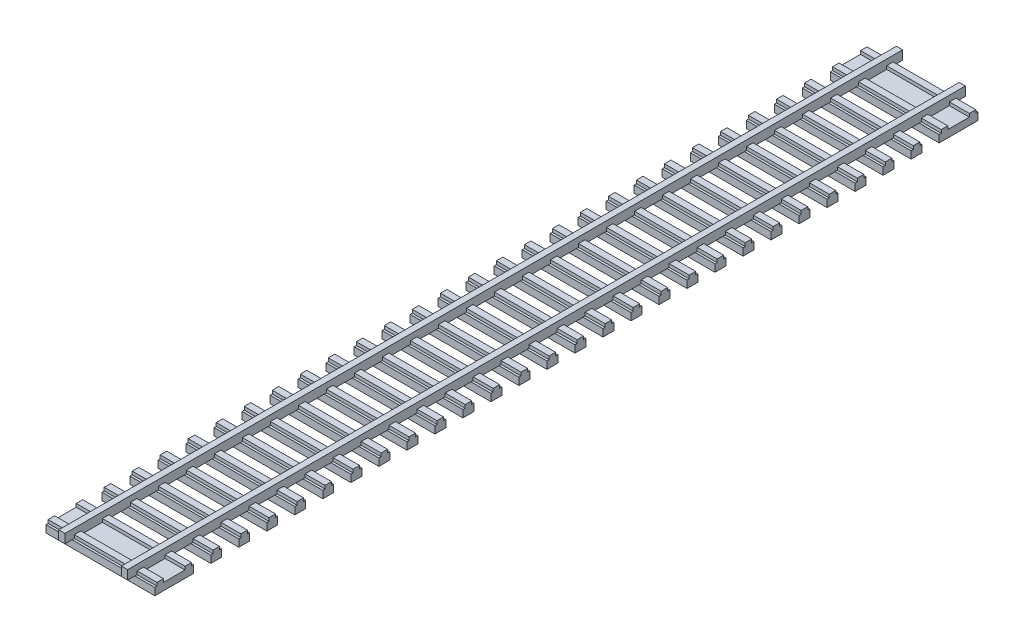
from build123d import *

# Parameters (mm, degrees)
SKETCH_1_W             = 1.71
SKETCH_1_H             = 2.5
EXTRUDE_1_DEPTH        = 115.5
EXTRUDE_1_2_DEPTH      = 115.5
SKETCH_2_W             = 3
SKETCH_2_H             = 2
SKETCH_2_W_2           = 1.8
SKETCH_2_H_2           = 0.9
EXTRUDE_2_DEPTH        = 15
PATTERN_LINEAR_1_COUNT = 30
PATTERN_LINEAR_1_PITCH = 7.724137931
SKETCH_3_W             = 4.724137931
SKETCH_3_H             = 2
EXTRUDE_3_DEPTH        = 30


with BuildPart() as part:
    # Эскиз1 → Бобышка-Вытянуть1 (new, symmetric)
    with BuildSketch(Plane.XY):
        with Locations((8.645, 1.25)):
            Rectangle(SKETCH_1_W, SKETCH_1_H)
    extrude(amount=EXTRUDE_1_DEPTH, both=True)



with BuildPart() as body_2:
    # Эскиз1 → Extrude 1 2 (new, symmetric)
    with BuildSketch(Plane.XY):
        with Locations((-8.645, 1.25)):
            Rectangle(SKETCH_1_W, SKETCH_1_H)
    extrude(amount=EXTRUDE_1_2_DEPTH, both=True)


with BuildPart() as part_1:
    add(part.part)

    add(body_2.part)  # Бобышка-Вытянуть2 merges body 2
    # Эскиз2 → Бобышка-Вытянуть2 (add, symmetric)
    with BuildSketch(Plane(origin=(0, 0, 0), x_dir=(0, 0, -1), z_dir=(1, 0, 0))):
        with Locations((-112, -1)):
            Rectangle(SKETCH_2_W, SKETCH_2_H)
        with Locations((-112, 0.45)):
            Rectangle(SKETCH_2_W_2, SKETCH_2_H_2)
    extrude_2 = extrude(amount=EXTRUDE_2_DEPTH, both=True)

    # Линейный массив1: Бобышка-Вытянуть2 ×30
    with Locations(*[(0, 0, -i * PATTERN_LINEAR_1_PITCH) for i in range(1, PATTERN_LINEAR_1_COUNT)]):
        add(extrude_2)

    # Эскиз3 → Бобышка-Вытянуть3 (add, through all)
    with BuildSketch(Plane(origin=(15, 0, 0), x_dir=(0, 0, -1), z_dir=(1, 0, 0))):
        with Locations((-108.137931035, -1)):
            Rectangle(SKETCH_3_W, SKETCH_3_H)
        with Locations((108.137931035, -1)):
            Rectangle(SKETCH_3_W, SKETCH_3_H)
    extrude(amount=-EXTRUDE_3_DEPTH)


solid = part_1.part
